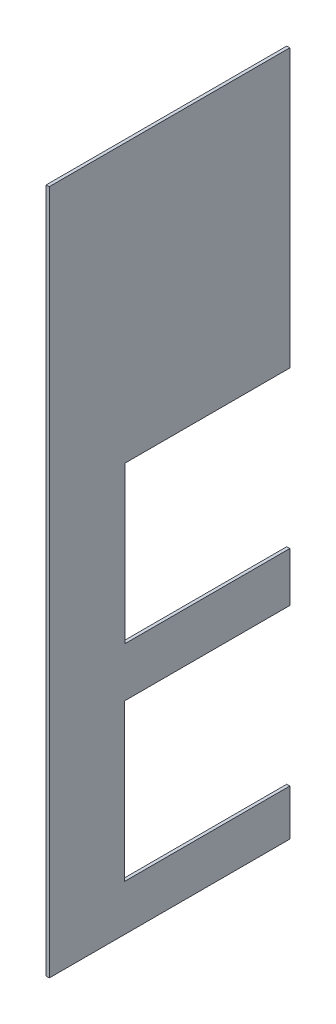
from build123d import *

# Parameters (mm, degrees)
SKETCH_1_W          = 110.7
SKETCH_1_H          = 38.85
EXTRUDE_1_DEPTH     = 0.5
CUT_EXTRUDE_1_DEPTH = 110.343655509


with BuildPart() as part:
    # Эскиз1 → Бобышка-Вытянуть1 (new body)
    with BuildSketch(Plane(origin=(0.5, 0, 0), x_dir=(0, -1, 0), z_dir=(-1, 0, 0))):
        with Locations((-45.5, 22.825)):
            Rectangle(SKETCH_1_W, SKETCH_1_H)
    extrude(amount=-EXTRUDE_1_DEPTH)

    # Эскиз3 → Вырез-Вытянуть1 (cut, through all)
    with BuildSketch(Plane.ZY.offset(-0.5)):
        Polygon((30.006561442, 30.807083884), (-3.688047368, 30.807082411), (-3.688047368, 56.057082411), (30.006560338, 56.057083884), align=None)
        Polygon((30.106561442, -2.417922215), (-3.688047368, -2.417923692), (-3.688047368, 22.832076308), (30.106560338, 22.832077785), align=None)
    extrude(amount=-CUT_EXTRUDE_1_DEPTH, mode=Mode.SUBTRACT)


solid = part.part
